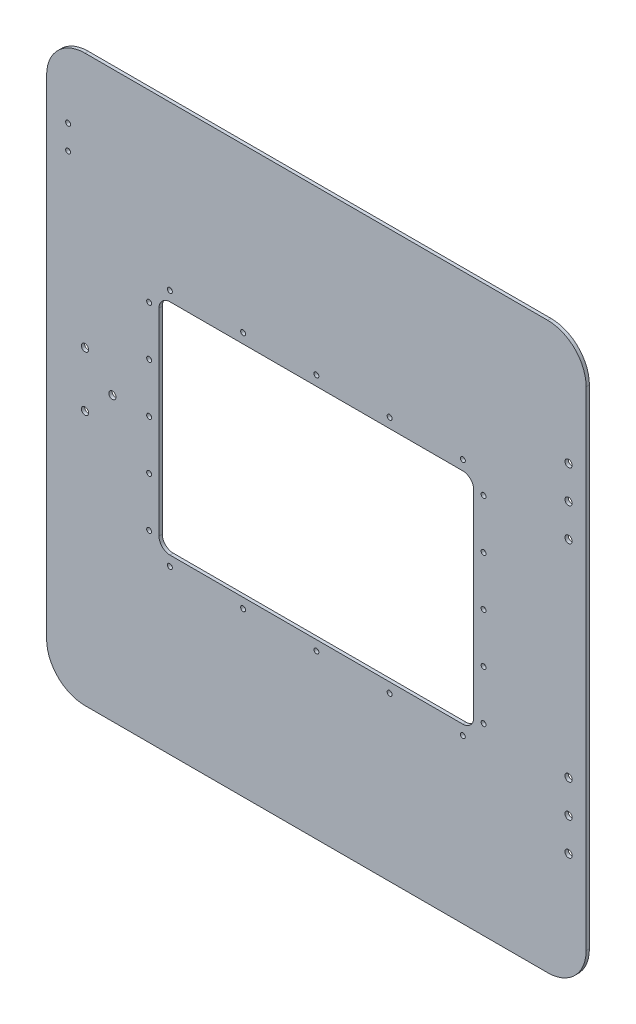
from build123d import *

# Parameters (mm, degrees)
SKETCH1_W            = 492
SKETCH1_H            = 515.3
BOSS_EXTRUDE1_DEPTH  = 1.5
M6_CLEARANCE_HOLE1_D = 6.6
M6_CLEARANCE_HOLE2_D = 6.6
FILLET1_R            = 35
CUT_EXTRUDE1_DEPTH   = 357.242224477
M4_CLEARANCE_HOLE1_D = 4.5
M4_CLEARANCE_HOLE2_D = 4.5


with BuildPart() as part:
    # Sketch1 → Boss-Extrude1 (new, symmetric)
    with BuildSketch(Plane.XY):
        Rectangle(SKETCH1_W, SKETCH1_H)
    extrude(amount=BOSS_EXTRUDE1_DEPTH, both=True)

    # M6 Clearance Hole1 (through all)
    with Locations(Plane(origin=(0, 0, -1.5), x_dir=(-1, 0, 0), z_dir=(0, 0, -1))):
        with Locations((-230, 154.116994756), (-230, 124.116994756), (-230, 94.116994756), (-230, -94.116994756), (-230, -124.116994756), (-230, -154.116994756)):
            Hole(M6_CLEARANCE_HOLE1_D / 2)

    # M6 Clearance Hole2 (through all)
    with Locations(Plane(origin=(0, 0, -1.5), x_dir=(-1, 0, 0), z_dir=(0, 0, -1))):
        with Locations((211, 25), (211, -25), (186, 0)):
            Hole(M6_CLEARANCE_HOLE2_D / 2)

    # Fillet1
    fillet1_edges = [part.edges().sort_by_distance(p)[0] for p in [
        (246, -257.65, 0),
        (-246, -257.65, 0),
        (-246, 257.65, 0),
        (246, 257.65, 0),
    ]]
    fillet(fillet1_edges, radius=FILLET1_R)

    # Sketch6 → Cut-Extrude1 (cut, through all)
    with BuildSketch(Plane(origin=(0, 0, -1.5), x_dir=(-1, 0, 0), z_dir=(0, 0, -1))):
        with BuildLine():
            Line((-133.5, -100), (133.5, -100))
            ThreePointArc((133.5, -100), (140.571067812, -97.071067812), (143.5, -90))
            Line((143.5, -90), (143.5, 90))
            ThreePointArc((143.5, 90), (140.571067812, 97.071067812), (133.5, 100))
            Line((133.5, 100), (-133.5, 100))
            ThreePointArc((-133.5, 100), (-140.571067812, 97.071067812), (-143.5, 90))
            Line((-143.5, 90), (-143.5, -90))
            ThreePointArc((-143.5, -90), (-140.571067812, -97.071067812), (-133.5, -100))
        make_face()
    extrude(amount=-CUT_EXTRUDE1_DEPTH, mode=Mode.SUBTRACT)

    # M4 Clearance Hole1 (through all)
    with Locations(Plane(origin=(0, 0, -1.5), x_dir=(-1, 0, 0), z_dir=(0, 0, -1))):
        with Locations((-133.6, -109), (-66.8, -109), (0, -109), (66.8, -109), (133.6, -109), (152.5, -90.1), (152.5, -45.05), (152.5, 0), (152.5, 45.05), (152.5, 90.1), (133.6, 109), (66.8, 109), (0, 109), (-66.8, 109), (-133.6, 109), (-152.5, 90.1), (-152.5, 45.05), (-152.5, 0), (-152.5, -45.05), (-152.5, -90.1)):
            Hole(M4_CLEARANCE_HOLE1_D / 2)

    # M4 Clearance Hole2 (through all)
    with Locations(Plane(origin=(0, 0, -1.5), x_dir=(-1, 0, 0), z_dir=(0, 0, -1))):
        with Locations((226.4, 194.65), (226.4, 172.65)):
            Hole(M4_CLEARANCE_HOLE2_D / 2)


solid = part.part
